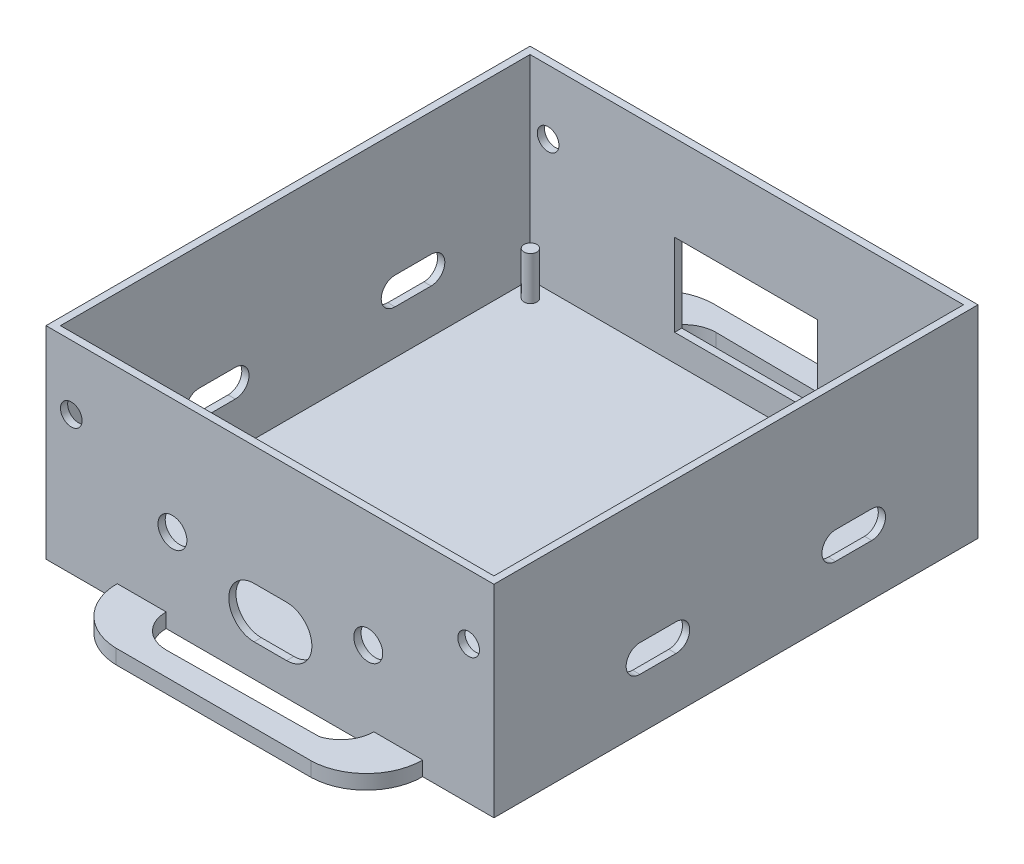
from build123d import *

# Parameters (mm, degrees)
SKETCH_1_W               = 62
SKETCH_1_H               = 67
EXTRUDE_1_DEPTH          = 1
SKETCH_3_R               = 0.9
EXTRUDE_2_DEPTH          = 6
SKETCH_5_W               = 62
SKETCH_5_H               = 67
SKETCH_5_W_2             = 60
SKETCH_5_H_2             = 65
EXTRUDE_3_DEPTH          = 27
SKETCH_6_W               = 19.8
SKETCH_6_H               = 11.4
CUT_EXTRUDE_1_DEPTH      = 2
CUT_EXTRUDE_2_DEPTH      = 76.830402874
CUT_EXTRUDE_2_DEPTH_BACK = 76.830402874
CUT_EXTRUDE_3_DEPTH      = 2
SKETCH_8_3_R             = 2
CUT_EXTRUDE_4_DEPTH      = 10
SKETCH_9_R               = 1.5
CUT_EXTRUDE_5_DEPTH      = 79.955683773
EXTRUDE_4_DEPTH          = 2


with BuildPart() as part:
    # Эскиз1 → Бобышка-Вытянуть1 (new body)
    with BuildSketch(Plane(origin=(0, 0, 0), x_dir=(1, 0, 0), z_dir=(0, 1, 0))):
        Rectangle(SKETCH_1_W, SKETCH_1_H)
    extrude(amount=EXTRUDE_1_DEPTH)

    # Эскиз3 → Бобышка-Вытянуть2 (add)
    with BuildSketch(Plane(origin=(0, 1, 0), x_dir=(1, 0, 0), z_dir=(0, 1, 0))):
        with Locations((27.75, -30.3)):
            Circle(SKETCH_3_R)
        with Locations((27.75, 30.3)):
            Circle(SKETCH_3_R)
        with Locations((-27.75, -30.3)):
            Circle(SKETCH_3_R)
        with Locations((-27.75, 30.3)):
            Circle(SKETCH_3_R)
    extrude(amount=EXTRUDE_2_DEPTH)

    # Эскиз5 → Бобышка-Вытянуть3 (add)
    with BuildSketch(Plane(origin=(0, 1, 0), x_dir=(1, 0, 0), z_dir=(0, 1, 0))):
        Rectangle(SKETCH_5_W, SKETCH_5_H)
        Rectangle(SKETCH_5_W_2, SKETCH_5_H_2, mode=Mode.SUBTRACT)
    extrude(amount=EXTRUDE_3_DEPTH)

    # Эскиз6 → Вырез-Вытянуть1 (cut)
    with BuildSketch(Plane(origin=(0, 0, -33.5), x_dir=(-1, 0, 0), z_dir=(0, 0, -1))):
        with Locations((0.1, 10.4)):
            Rectangle(SKETCH_6_W, SKETCH_6_H)
    extrude(amount=-CUT_EXTRUDE_1_DEPTH, mode=Mode.SUBTRACT)

    # Эскиз7 → Вырез-Вытянуть2 (cut, two sides: drawn at the far end of the back side and taken through both)
    with BuildSketch(Plane(origin=(31, 0, 0), x_dir=(0, 0, -1), z_dir=(1, 0, 0)).offset(-CUT_EXTRUDE_2_DEPTH_BACK)):
        with BuildLine():
            Line((-13.3, 10.9), (-8.3, 10.9))
            ThreePointArc((-8.3, 10.9), (-6.4, 9), (-8.3, 7.1))
            Line((-8.3, 7.1), (-13.3, 7.1))
            ThreePointArc((-13.3, 7.1), (-15.2, 9), (-13.3, 10.9))
        make_face()
        with BuildLine():
            Line((13.8, 10.9), (18.8, 10.9))
            ThreePointArc((18.8, 10.9), (20.7, 9), (18.8, 7.1))
            Line((18.8, 7.1), (13.8, 7.1))
            ThreePointArc((13.8, 7.1), (11.9, 9), (13.8, 10.9))
        make_face()
    extrude(amount=CUT_EXTRUDE_2_DEPTH + CUT_EXTRUDE_2_DEPTH_BACK, mode=Mode.SUBTRACT)

    # Эскиз8 → Вырез-Вытянуть3 (cut)
    with BuildSketch(Plane.XY.offset(33.5)):
        with BuildLine():
            Line((-2.2, 4.5), (2.3, 4.5))
            ThreePointArc((2.3, 4.5), (5.8, 8), (2.3, 11.5))
            Line((2.3, 11.5), (-2.2, 11.5))
            ThreePointArc((-2.2, 11.5), (-5.7, 8), (-2.2, 4.5))
        make_face()
    extrude(amount=-CUT_EXTRUDE_3_DEPTH, mode=Mode.SUBTRACT)

    # Эскиз8<3> → Вырез-Вытянуть4 (cut)
    with BuildSketch(Plane.XY.offset(33.5)):
        with Locations((-13.5, 12)):
            Circle(SKETCH_8_3_R)
        with Locations((13.6, 12)):
            Circle(SKETCH_8_3_R)
    extrude(amount=-CUT_EXTRUDE_4_DEPTH, mode=Mode.SUBTRACT)

    # Эскиз9 → Вырез-Вытянуть5 (cut, through all)
    with BuildSketch(Plane.XY.offset(33.5)):
        with Locations((-27.5, 19.1)):
            Circle(SKETCH_9_R)
        with Locations((27.5, 19.1)):
            Circle(SKETCH_9_R)
    extrude(amount=-CUT_EXTRUDE_5_DEPTH, mode=Mode.SUBTRACT)

    # Эскиз10 → Бобышка-Вытянуть4 (add)
    with BuildSketch(Plane.XZ):
        with BuildLine():
            Line((14.370902848, -33.5), (21.143202049, -33.5))
            ThreePointArc((21.143202049, -33.5), (18.914555679, -38.964375793), (13.5, -41.311470647))
            Line((13.5, -41.311470647), (-13.5, -41.311470647))
            ThreePointArc((-13.5, -41.311470647), (-18.914555679, -38.964375793), (-21.143202049, -33.5))
            Line((-21.143202049, -33.5), (-14.370902848, -33.5))
            ThreePointArc((-14.370902848, -33.5), (-13.034801548, -36.725633878), (-9.80916767, -38.061735178))
            Line((-9.80916767, -38.061735178), (11.18974267, -37.847808701))
            ThreePointArc((11.18974267, -37.847808701), (13.490692176, -36.193660176), (14.370902848, -33.5))
        make_face()
        with BuildLine():
            Line((-21.143202049, 33.5), (-14.39209337, 33.5))
            Line((-14.39209337, 33.5), (-14.370902848, 33.5))
            ThreePointArc((-14.370902848, 33.5), (-13.034801548, 36.725633878), (-9.80916767, 38.061735178))
            Line((-9.80916767, 38.061735178), (11.18974267, 37.847808701))
            ThreePointArc((11.18974267, 37.847808701), (13.490692176, 36.193660176), (14.370902848, 33.5))
            Line((14.370902848, 33.5), (21.143202049, 33.5))
            ThreePointArc((21.143202049, 33.5), (18.914555679, 38.964375793), (13.5, 41.311470647))
            Line((13.5, 41.311470647), (-13.5, 41.311470647))
            ThreePointArc((-13.5, 41.311470647), (-18.914555679, 38.964375793), (-21.143202049, 33.5))
        make_face()
    extrude(amount=-EXTRUDE_4_DEPTH)


solid = part.part
